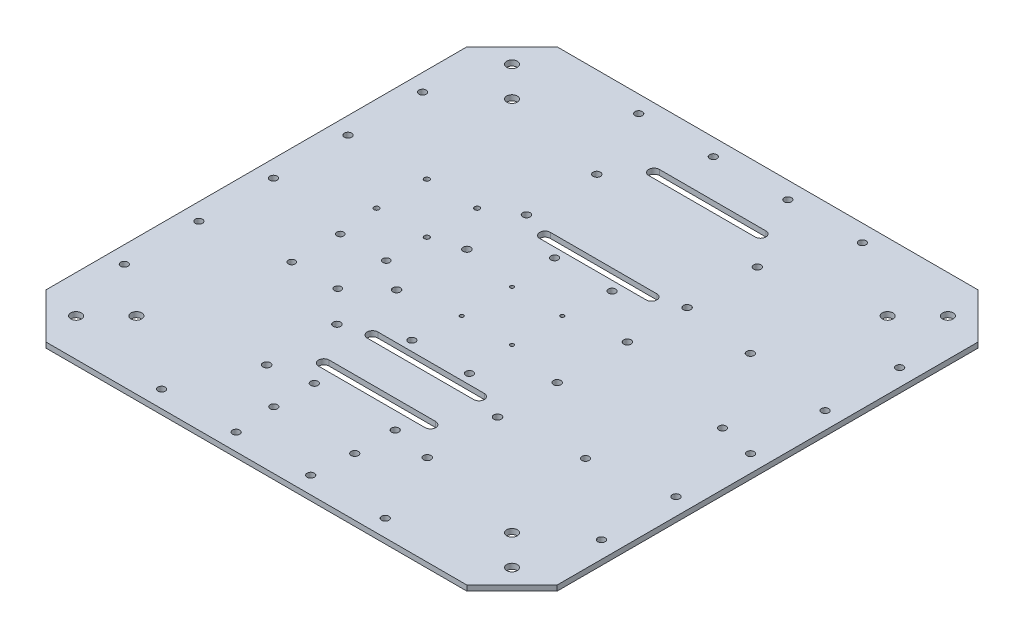
from build123d import *

# Parameters (mm, degrees)
BOSS_EXTRUDE1_DEPTH = 3.175
SKETCH2_R           = 2.159
CUT_EXTRUDE1_DEPTH  = 297.247830215
CUT_EXTRUDE2_DEPTH  = 297.247830215
SKETCH7_R           = 1.524
CUT_EXTRUDE3_DEPTH  = 297.247830215
SKETCH10_R          = 2.159
CUT_EXTRUDE6_DEPTH  = 297.247830215
SKETCH9_R           = 2.032
CUT_EXTRUDE5_DEPTH  = 297.247830215
SKETCH13_R          = 1.1
CUT_EXTRUDE8_DEPTH  = 297.247830215
SKETCH14_R          = 3.175
CUT_EXTRUDE9_DEPTH  = 297.247830215
SKETCH15_R          = 2.159
CUT_EXTRUDE10_DEPTH = 297.247830215
SKETCH16_R          = 2.159
CUT_EXTRUDE11_DEPTH = 297.247830215
SKETCH17_R          = 2.2225
CUT_EXTRUDE13_DEPTH = 297.247830215


with BuildPart() as part:
    # Sketch1 → Boss-Extrude1 (new body)
    with BuildSketch(Plane(origin=(0, 0, 0), x_dir=(1, 0, 0), z_dir=(0, 1, 0))):
        Polygon((-94.345284264, 72.258976948), (-121.286052627, 45.318208585), (-121.286052627, -205.600254688), (-94.345284264, -232.541023052), (156.573179009, -232.541023052), (183.513947373, -205.600254688), (183.513947373, 45.318208585), (156.573179009, 72.258976948), align=None)
    extrude(amount=BOSS_EXTRUDE1_DEPTH)

    # Sketch2 → Cut-Extrude1 (cut, through all)
    with BuildSketch(Plane(origin=(0, 3.175, 0), x_dir=(1, 0, 0), z_dir=(0, 1, 0))):
        with Locations(Location((13.841947373, -37.469023052, 0), (0, 0, 270))):
            Circle(SKETCH2_R)
        with Locations(Location((48.131947373, -37.469023052, 0), (0, 0, 270))):
            Circle(SKETCH2_R)
        with Locations(Location((13.841947373, -122.559023052, 0), (0, 0, 270))):
            Circle(SKETCH2_R)
        with Locations(Location((48.131947373, -122.559023052, 0), (0, 0, 270))):
            Circle(SKETCH2_R)
    extrude(amount=-CUT_EXTRUDE1_DEPTH, mode=Mode.SUBTRACT)

    # Sketch4 → Cut-Extrude2 (cut, through all)
    with BuildSketch(Plane(origin=(0, 3.175, 0), x_dir=(1, 0, 0), z_dir=(0, 1, 0))):
        with BuildLine():
            Line((-0.636052627, 39.468976948), (62.863947373, 39.468976948))
            ThreePointArc((62.863947373, 39.468976948), (66.038947373, 36.293976948), (62.863947373, 33.118976948))
            Line((62.863947373, 33.118976948), (-0.636052627, 33.118976948))
            ThreePointArc((-0.636052627, 33.118976948), (-3.811052627, 36.293976948), (-0.636052627, 39.468976948))
        make_face()
        with BuildLine():
            Line((-0.636052627, -25.531023052), (62.863947373, -25.531023052))
            ThreePointArc((62.863947373, -25.531023052), (66.038947373, -28.706023052), (62.863947373, -31.881023052))
            Line((62.863947373, -31.881023052), (-0.636052627, -31.881023052))
            ThreePointArc((-0.636052627, -31.881023052), (-3.811052627, -28.706023052), (-0.636052627, -25.531023052))
        make_face()
        with BuildLine():
            Line((-0.636052627, -128.401023052), (62.863947373, -128.401023052))
            ThreePointArc((62.863947373, -128.401023052), (66.038947373, -131.576023052), (62.863947373, -134.751023052))
            Line((62.863947373, -134.751023052), (-0.636052627, -134.751023052))
            ThreePointArc((-0.636052627, -134.751023052), (-3.811052627, -131.576023052), (-0.636052627, -128.401023052))
        make_face()
        with BuildLine():
            Line((-0.636052627, -157.401023052), (62.863947373, -157.401023052))
            ThreePointArc((62.863947373, -157.401023052), (66.038947373, -160.576023052), (62.863947373, -163.751023052))
            Line((62.863947373, -163.751023052), (-0.636052627, -163.751023052))
            ThreePointArc((-0.636052627, -163.751023052), (-3.811052627, -160.576023052), (-0.636052627, -157.401023052))
        make_face()
    extrude(amount=-CUT_EXTRUDE2_DEPTH, mode=Mode.SUBTRACT)

    # Sketch7 → Cut-Extrude3 (cut, through all)
    with BuildSketch(Plane(origin=(0, 3.175, 0), x_dir=(1, 0, 0), z_dir=(0, 1, 0))):
        with Locations(Location((-34.926052627, -34.929023052, 0), (0, 0, 270))):
            Circle(SKETCH7_R)
        with Locations(Location((-34.926052627, -64.901023052, 0), (0, 0, 270))):
            Circle(SKETCH7_R)
        with Locations(Location((-64.898052627, -64.901023052, 0), (0, 0, 90))):
            Circle(SKETCH7_R)
        with Locations(Location((-64.898052627, -34.929023052, 0), (0, 0, 90))):
            Circle(SKETCH7_R)
    extrude(amount=-CUT_EXTRUDE3_DEPTH, mode=Mode.SUBTRACT)

    # Sketch10 → Cut-Extrude6 (cut, through all)
    with BuildSketch(Plane.XZ):
        with Locations(Location((6.983947373, 198.041023052, 0), (0, 0, 270))):
            Circle(SKETCH10_R)
        with Locations(Location((55.243947373, 198.041023052, 0), (0, 0, 270))):
            Circle(SKETCH10_R)
        with Locations(Location((6.983947373, 173.911023052, 0), (0, 0, 270))):
            Circle(SKETCH10_R)
        with Locations(Location((55.243947373, 173.911023052, 0), (0, 0, 270))):
            Circle(SKETCH10_R)
    extrude(amount=-CUT_EXTRUDE6_DEPTH, mode=Mode.SUBTRACT)

    # Sketch9 → Cut-Extrude5 (cut, through all)
    with BuildSketch(Plane(origin=(0, 0, 0), x_dir=(-1, 0, 0), z_dir=(0, -1, 0))):
        with Locations(Location((62.358052627, -117.987023052, 0), (0, 0, 90))):
            Circle(SKETCH9_R)
        with Locations(Location((34.926052627, -117.987023052, 0), (0, 0, 270))):
            Circle(SKETCH9_R)
        with Locations(Location((62.358052627, -89.031023052, 0), (0, 0, 90))):
            Circle(SKETCH9_R)
        with Locations(Location((34.926052627, -89.031023052, 0), (0, 0, 270))):
            Circle(SKETCH9_R)
    extrude(amount=-CUT_EXTRUDE5_DEPTH, mode=Mode.SUBTRACT)

    # Sketch13 → Cut-Extrude8 (cut, through all)
    with BuildSketch(Plane.XZ):
        with Locations(Location((16.113947373, 95.141023052, 0), (0, 0, 270))):
            Circle(SKETCH13_R)
        with Locations(Location((16.113947373, 65.141023052, 0), (0, 0, 270))):
            Circle(SKETCH13_R)
        with Locations(Location((46.113947373, 65.141023052, 0), (0, 0, 90))):
            Circle(SKETCH13_R)
        with Locations(Location((46.113947373, 95.141023052, 0), (0, 0, 90))):
            Circle(SKETCH13_R)
    extrude(amount=-CUT_EXTRUDE8_DEPTH, mode=Mode.SUBTRACT)

    # Sketch14 → Cut-Extrude9 (cut, through all)
    with BuildSketch(Plane.XZ):
        with Locations(Location((-98.835412325, 210.090382749, 0), (0, 0, 270))):
            Circle(SKETCH14_R)
        with Locations(Location((-80.874900083, 192.129870507, 0), (0, 0, 270))):
            Circle(SKETCH14_R)
        with Locations(Location((143.102794828, 192.129870507, 0), (0, 0, 90))):
            Circle(SKETCH14_R)
        with Locations(Location((161.06330707, 210.090382749, 0), (0, 0, 90))):
            Circle(SKETCH14_R)
        with Locations(Location((-98.835412325, -49.808336646, 0), (0, 0, 90))):
            Circle(SKETCH14_R)
        with Locations(Location((-80.874900083, -31.847824404, 0), (0, 0, 90))):
            Circle(SKETCH14_R)
        with Locations(Location((161.06330707, -49.808336646, 0), (0, 0, 270))):
            Circle(SKETCH14_R)
        with Locations(Location((143.102794828, -31.847824404, 0), (0, 0, 270))):
            Circle(SKETCH14_R)
    extrude(amount=-CUT_EXTRUDE9_DEPTH, mode=Mode.SUBTRACT)

    # Sketch15 → Cut-Extrude10 (cut, through all)
    with BuildSketch(Plane.XZ):
        with Locations(Location((8.888947373, 222.381023052, 0), (0, 0, 270))):
            Circle(SKETCH15_R)
        with Locations(Location((-35.561052627, 222.381023052, 0), (0, 0, 270))):
            Circle(SKETCH15_R)
        with Locations(Location((-111.126052627, 80.141023052, 0), (0, 0, 270))):
            Circle(SKETCH15_R)
        with Locations(Location((-111.126052627, 124.591023052, 0), (0, 0, 270))):
            Circle(SKETCH15_R)
        with Locations(Location((-111.126052627, 169.041023052, 0), (0, 0, 270))):
            Circle(SKETCH15_R)
        with Locations(Location((173.353947373, 169.041023052, 0), (0, 0, 90))):
            Circle(SKETCH15_R)
        with Locations(Location((173.353947373, 124.591023052, 0), (0, 0, 90))):
            Circle(SKETCH15_R)
        with Locations(Location((173.353947373, 80.141023052, 0), (0, 0, 90))):
            Circle(SKETCH15_R)
        with Locations(Location((97.788947373, 222.381023052, 0), (0, 0, 90))):
            Circle(SKETCH15_R)
        with Locations(Location((53.338947373, 222.381023052, 0), (0, 0, 90))):
            Circle(SKETCH15_R)
        with Locations(Location((53.338947373, -62.098976948, 0), (0, 0, 270))):
            Circle(SKETCH15_R)
        with Locations(Location((97.788947373, -62.098976948, 0), (0, 0, 270))):
            Circle(SKETCH15_R)
        with Locations(Location((173.353947373, 35.691023052, 0), (0, 0, 270))):
            Circle(SKETCH15_R)
        with Locations(Location((173.353947373, -8.758976948, 0), (0, 0, 270))):
            Circle(SKETCH15_R)
        with Locations(Location((-111.126052627, -8.758976948, 0), (0, 0, 90))):
            Circle(SKETCH15_R)
        with Locations(Location((-111.126052627, 35.691023052, 0), (0, 0, 90))):
            Circle(SKETCH15_R)
        with Locations(Location((-35.561052627, -62.098976948, 0), (0, 0, 90))):
            Circle(SKETCH15_R)
        with Locations(Location((8.888947373, -62.098976948, 0), (0, 0, 90))):
            Circle(SKETCH15_R)
    extrude(amount=-CUT_EXTRUDE10_DEPTH, mode=Mode.SUBTRACT)

    # Sketch16 → Cut-Extrude11 (cut, through all)
    with BuildSketch(Plane(origin=(0, 0, 0), x_dir=(-1, 0, 0), z_dir=(0, -1, 0))):
        with Locations(Location((-126.617947373, -131.830023052, 0), (0, 0, 90))):
            Circle(SKETCH16_R)
        with Locations(Location((-121.537947373, -28.452023052, 0), (0, 0, 90))):
            Circle(SKETCH16_R)
        with Locations(Location((-151.763947373, -75.274023052, 0), (0, 0, 90))):
            Circle(SKETCH16_R)
    extrude(amount=-CUT_EXTRUDE11_DEPTH, mode=Mode.SUBTRACT)

    # Sketch17 → Cut-Extrude13 (cut, through all)
    with BuildSketch(Plane(origin=(0, 3.175, 0), x_dir=(1, 0, 0), z_dir=(0, 1, 0))):
        with Locations(Location((78.992947373, -178.566023052, 0), (0, 0, 270))):
            Circle(SKETCH17_R)
        with Locations(Location((-16.765052627, -178.566023052, 0), (0, 0, 270))):
            Circle(SKETCH17_R)
        with Locations(Location((78.992947373, -136.656023052, 0), (0, 0, 270))):
            Circle(SKETCH17_R)
        with Locations(Location((-16.765052627, -136.656023052, 0), (0, 0, 270))):
            Circle(SKETCH17_R)
        with Locations(Location((78.992947373, -101.096023052, 0), (0, 0, 270))):
            Circle(SKETCH17_R)
        with Locations(Location((-16.765052627, -101.096023052, 0), (0, 0, 270))):
            Circle(SKETCH17_R)
        with Locations(Location((78.992947373, -59.186023052, 0), (0, 0, 270))):
            Circle(SKETCH17_R)
        with Locations(Location((-16.765052627, -59.186023052, 0), (0, 0, 270))):
            Circle(SKETCH17_R)
        with Locations(Location((78.992947373, -23.626023052, 0), (0, 0, 270))):
            Circle(SKETCH17_R)
        with Locations(Location((-16.765052627, -23.626023052, 0), (0, 0, 270))):
            Circle(SKETCH17_R)
        with Locations(Location((78.992947373, 18.283976948, 0), (0, 0, 270))):
            Circle(SKETCH17_R)
        with Locations(Location((-16.765052627, 18.283976948, 0), (0, 0, 270))):
            Circle(SKETCH17_R)
    extrude(amount=-CUT_EXTRUDE13_DEPTH, mode=Mode.SUBTRACT)


solid = part.part
